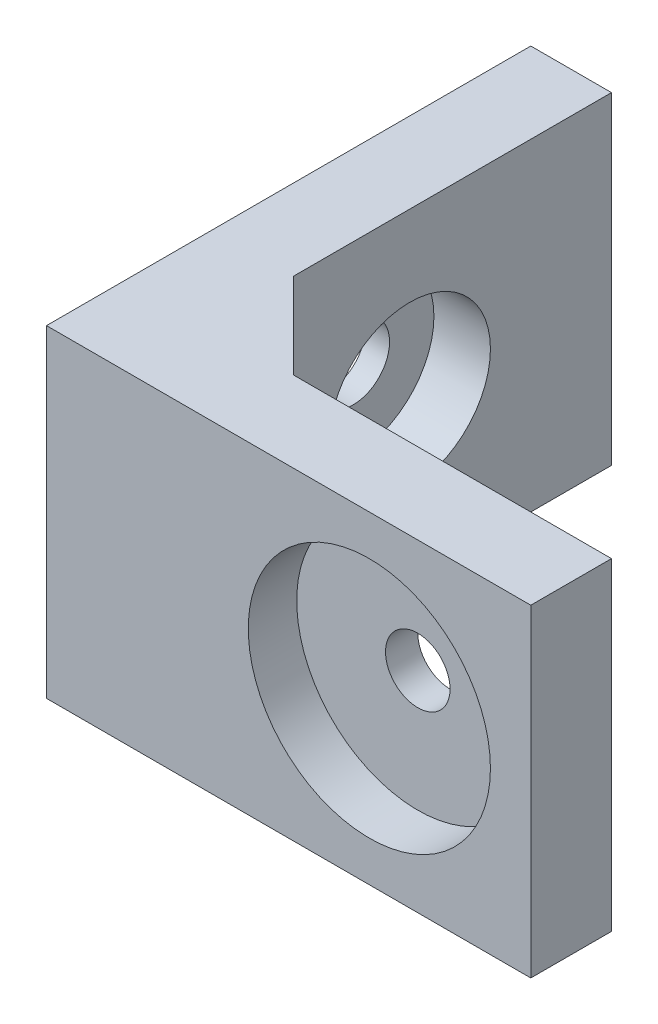
from build123d import *

# Parameters (mm, degrees)
ESTRUSIONE_ESTRUSIONE2_DEPTH                         = 20
FORO_LAMATO_PER_VITE_M4_A_TESTA_CILINDRI_D           = 4.5
FORO_LAMATO_PER_VITE_M4_A_TESTA_CILINDRI_DEPTH       = 15
FORO_LAMATO_PER_VITE_M4_A_TESTA_CILINDRI_CBORE_D     = 10
FORO_LAMATO_PER_VITE_M4_A_TESTA_CILINDRI_CBORE_DEPTH = 3.5
FORO_LAMATO_PER_VITE_M4_A_TESTA_CILINDRI_TIP         = 1.351936393
SCHIZZO6_R                                           = 7.5
TAGLIO_ESTRUSIONE1_DEPTH                             = 3
FORO_PER_VITE_M4_1_D                                 = 4
FORO_PER_VITE_M4_1_DEPTH                             = 9
FORO_PER_VITE_M4_1_TIP                               = 1.201721238


with BuildPart() as part:
    # Schizzo2 → Estrusione-Estrusione2 (new body)
    with BuildSketch(Plane(origin=(0, 0, 0), x_dir=(1, 0, 0), z_dir=(0, 1, 0))):
        Polygon((5, 30), (5, 10.303300859), (10.303300859, 5), (30, 5), (30, 0), (0, 0), (0, 30), align=None)
    extrude(amount=ESTRUSIONE_ESTRUSIONE2_DEPTH)

    # Foro lamato per Vite M4 a testa cilindrica piana-1
    with Locations(Plane(origin=(5, 0, 0), x_dir=(0, 0, -1), z_dir=(1, 0, 0))):
        with Locations((17.5, 10)):
            CounterBoreHole(FORO_LAMATO_PER_VITE_M4_A_TESTA_CILINDRI_D / 2, FORO_LAMATO_PER_VITE_M4_A_TESTA_CILINDRI_CBORE_D / 2, FORO_LAMATO_PER_VITE_M4_A_TESTA_CILINDRI_CBORE_DEPTH, depth=FORO_LAMATO_PER_VITE_M4_A_TESTA_CILINDRI_DEPTH)
            with Locations((0, 0, -(FORO_LAMATO_PER_VITE_M4_A_TESTA_CILINDRI_DEPTH + FORO_LAMATO_PER_VITE_M4_A_TESTA_CILINDRI_TIP / 2))):  # 118° drill point
                Cone(0, FORO_LAMATO_PER_VITE_M4_A_TESTA_CILINDRI_D / 2, FORO_LAMATO_PER_VITE_M4_A_TESTA_CILINDRI_TIP, mode=Mode.SUBTRACT)

    # Schizzo6 → Taglio-Estrusione1 (cut)
    with BuildSketch(Plane.XY):
        with Locations((20, 10)):
            Circle(SCHIZZO6_R)
    extrude(amount=-TAGLIO_ESTRUSIONE1_DEPTH, mode=Mode.SUBTRACT)

    # Foro per Vite M4-1
    with Locations(Plane(origin=(20, 10, 0), x_dir=(1, 0, 0), z_dir=(0, 0, 1))):
        with Locations((0, 0)):
            Hole(FORO_PER_VITE_M4_1_D / 2, depth=FORO_PER_VITE_M4_1_DEPTH)
            with Locations((0, 0, -(FORO_PER_VITE_M4_1_DEPTH + FORO_PER_VITE_M4_1_TIP / 2))):  # 118° drill point
                Cone(0, FORO_PER_VITE_M4_1_D / 2, FORO_PER_VITE_M4_1_TIP, mode=Mode.SUBTRACT)


solid = part.part
